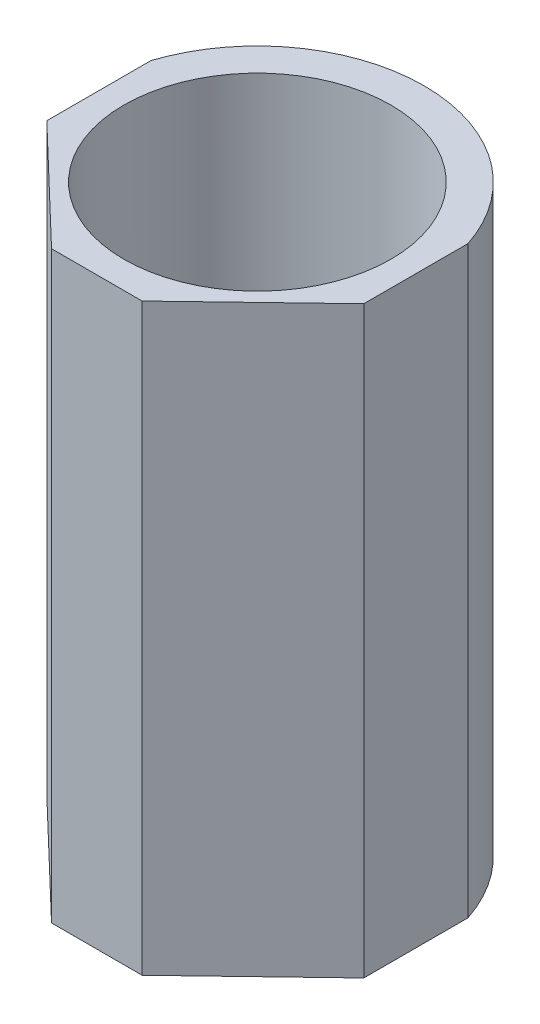
from build123d import *

# Parameters (mm, degrees)
SKETCH1_R               = 20
SKETCH1_R_2             = 16.01
BOSS_EXTRUDE1_DEPTH     = 70
CUT_EXTRUDE1_DEPTH      = 76.498344353
CUT_EXTRUDE1_DEPTH_BACK = 76.498344353
SKETCH3_R               = 16.01
BOSS_EXTRUDE2_DEPTH     = 30
CUT_EXTRUDE2_DEPTH      = 49.590122453
CUT_EXTRUDE2_DEPTH_BACK = 49.590122453
SKETCH4_R               = 3.326


with BuildPart() as part:
    # Sketch1 → Boss-Extrude1 (new body)
    with BuildSketch(Plane(origin=(0, 0, 0), x_dir=(1, 0, 0), z_dir=(0, 1, 0))):
        with Locations(Location((0, 0, 0), (0, 0, 270))):
            Circle(SKETCH1_R)
        with Locations(Location((0, 0, 0), (0, 0, 270))):
            Circle(SKETCH1_R_2, mode=Mode.SUBTRACT)
    extrude(amount=BOSS_EXTRUDE1_DEPTH)

    # Sketch2 → Cut-Extrude1 (cut, two sides: drawn at the far end of the back side and taken through both)
    with BuildSketch(Plane(origin=(0, 70, 0), x_dir=(1, 0, 0), z_dir=(0, 1, 0)).offset(-CUT_EXTRUDE1_DEPTH_BACK)):
        with BuildLine():
            Line((-19, -6.244997998), (-19, 6.244997998))
            ThreePointArc((-19, 6.244997998), (-20, 0), (-19, -6.244997998))
        make_face()
        with BuildLine():
            Line((-5.4292033, -19.24899352), (-19, -6.244997998))
            ThreePointArc((-19, -6.244997998), (-13.837357709, -14.44048239), (-5.4292033, -19.24899352))
        make_face()
        with BuildLine():
            ThreePointArc((5.4292033, -19.24899352), (13.837357709, -14.44048239), (19, -6.244997998))
            Line((19, -6.244997998), (5.4292033, -19.24899352))
        make_face()
        with BuildLine():
            Line((0, -19.24899352), (-5.4292033, -19.24899352))
            ThreePointArc((-5.4292033, -19.24899352), (-2.740449745, -19.811358742), (0, -20))
            Line((0, -20), (0, -19.24899352))
        make_face()
        with BuildLine():
            Line((5.4292033, -19.24899352), (0, -19.24899352))
            Line((0, -19.24899352), (0, -20))
            ThreePointArc((0, -20), (2.740449745, -19.811358742), (5.4292033, -19.24899352))
        make_face()
        with BuildLine():
            ThreePointArc((20, 0), (19.748417658, 3.16227766), (19, 6.244997998))
            Line((19, 6.244997998), (19, -6.244997998))
            ThreePointArc((19, -6.244997998), (19.748417658, -3.16227766), (20, 0))
        make_face()
    extrude(amount=CUT_EXTRUDE1_DEPTH + CUT_EXTRUDE1_DEPTH_BACK, mode=Mode.SUBTRACT)

    # Sketch3 → Boss-Extrude2 (add)
    with BuildSketch(Plane.XZ):
        with Locations(Location((0, 0, 0), (0, 0, 270))):
            Circle(SKETCH3_R)
    extrude(amount=-BOSS_EXTRUDE2_DEPTH)

    # Sketch4 → Cut-Extrude2 (cut, two sides: drawn at the far end of the back side and taken through both)
    with BuildSketch(Plane(origin=(0, 30, 0), x_dir=(1, 0, 0), z_dir=(0, 1, 0)).offset(-CUT_EXTRUDE2_DEPTH_BACK)):
        with Locations(Location((0, 0, 0), (0, 0, 270))):
            Circle(SKETCH4_R)
    extrude(amount=CUT_EXTRUDE2_DEPTH + CUT_EXTRUDE2_DEPTH_BACK, mode=Mode.SUBTRACT)


solid = part.part
